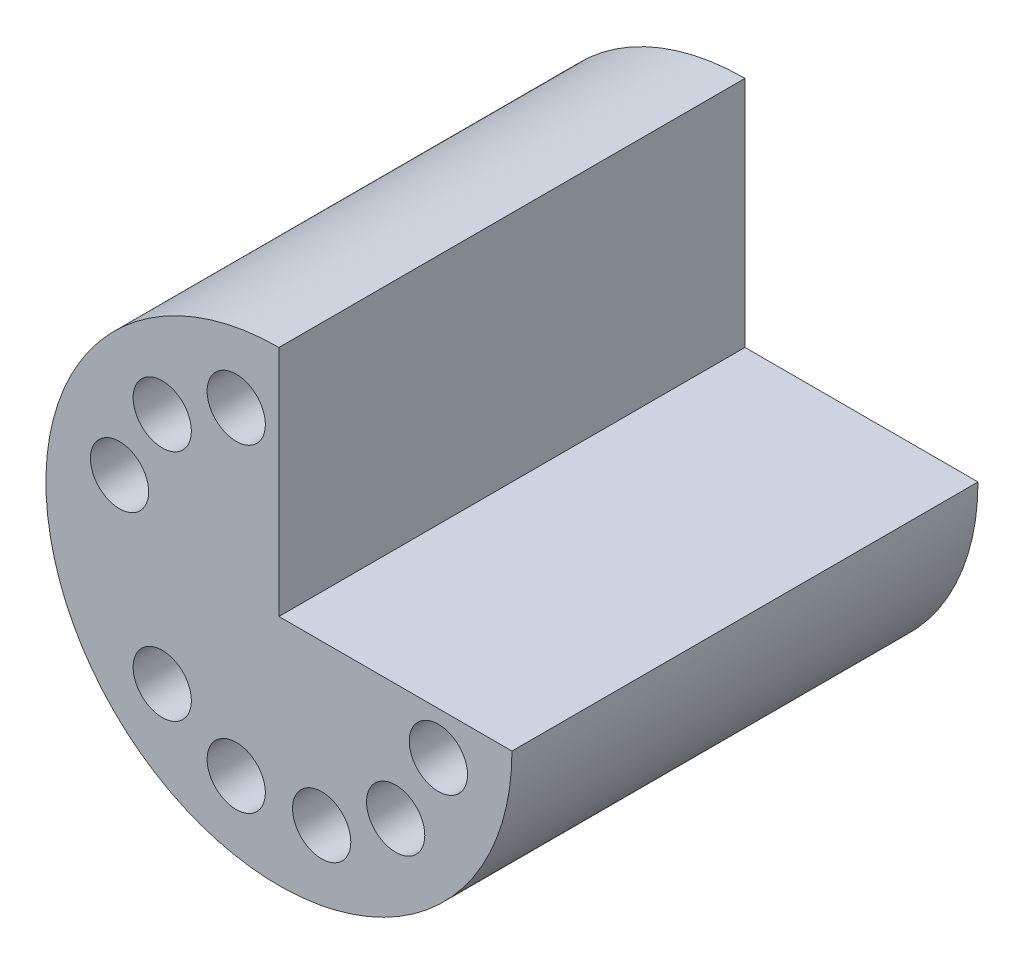
from build123d import *

# Parameters (mm, degrees)
BOSS_EXTRUDE1_DEPTH = 152.4
SKETCH2_R           = 9.525
CUT_EXTRUDE1_DEPTH  = 187.6511184
CIRPATTERN1_COUNT   = 9
CIRPATTERN1_ANGLE   = 240


with BuildPart() as part:
    # Sketch1 → Boss-Extrude1 (new body)
    with BuildSketch(Plane.XY):
        with BuildLine():
            Line((0, 76.2), (0, 0))
            Line((0, 0), (76.2, 0))
            ThreePointArc((76.2, 0), (-53.881536726, -53.881536726), (0, 76.2))
        make_face()
    extrude(amount=-BOSS_EXTRUDE1_DEPTH)

    # Sketch2 → Cut-Extrude1 (cut, through all)
    with BuildSketch(Plane.XY):
        with Locations((-13.969757959, 52.135846474)):
            Circle(SKETCH2_R)
    cut_extrude1 = extrude(amount=-CUT_EXTRUDE1_DEPTH, mode=Mode.SUBTRACT)

    # CirPattern1: Cut-Extrude1 ×9 about axis, 1 skipped
    cirpattern1_axis = Axis((0, 0, 0), (0, 0, 1))
    add([cut_extrude1.rotate(cirpattern1_axis, i * CIRPATTERN1_ANGLE / (CIRPATTERN1_COUNT - 1)) for i in range(1, CIRPATTERN1_COUNT) if i not in (3,)], mode=Mode.SUBTRACT)


solid = part.part
